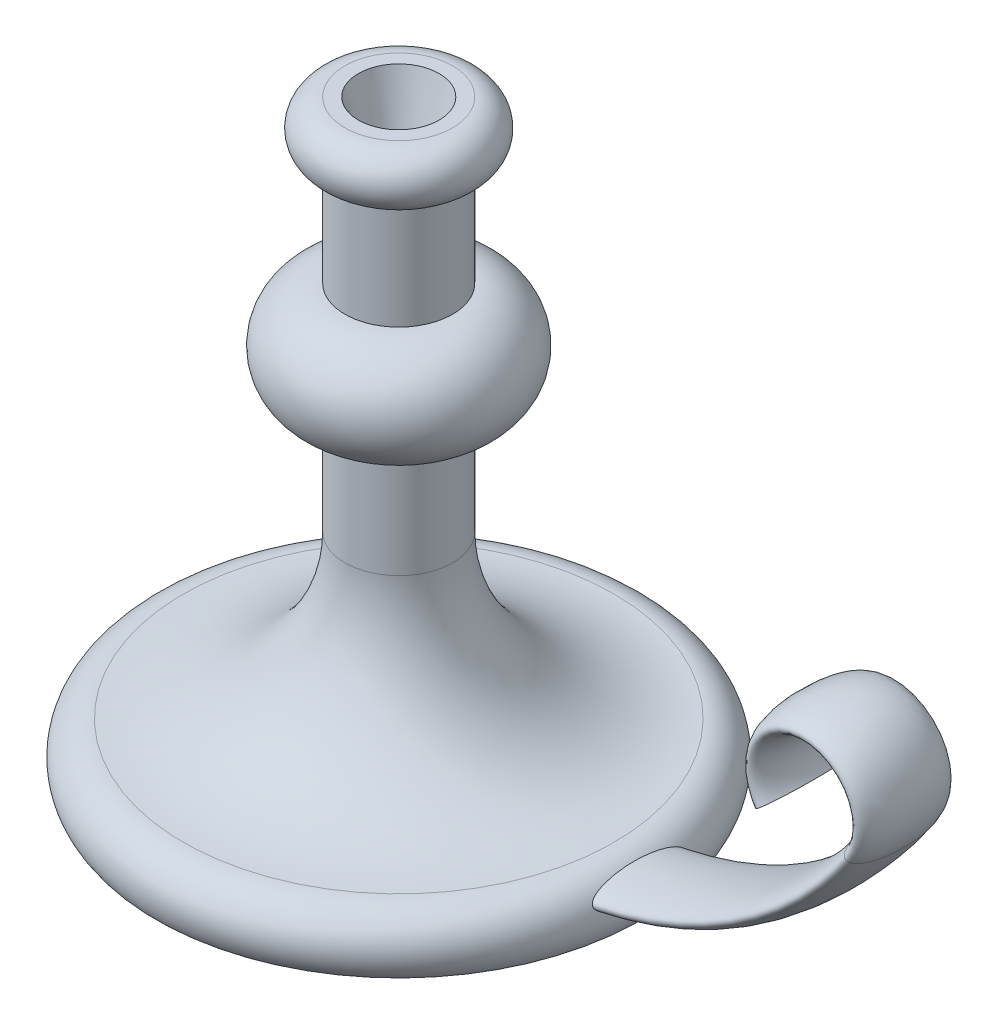
from build123d import *

# Parameters (mm, degrees)
SKETCH3_RX         = 17.5
SKETCH3_RY         = 5
SKETCH4_R          = 15
CUT_EXTRUDE2_DEPTH = 25
CUT_EXTRUDE2_DRAFT = -15


with BuildPart() as part:
    # Sketch1 → Revolve1 (revolve)
    with BuildSketch(Plane.XY, mode=Mode.PRIVATE) as revolve1_sk:
        with BuildLine():
            Line((0, 0), (0, 220))
            Line((0, 220), (20, 220))
            ThreePointArc((20, 220), (30, 210), (20, 200))
            Line((20, 200), (20, 160))
            ThreePointArc((20, 160), (40, 140), (20, 120))
            Line((20, 120), (20, 80))
            ThreePointArc((20, 80), (37.573593129, 37.573593129), (80, 20))
            ThreePointArc((80, 20), (91.180339887, 13.090169944), (90, 0))
            Line((90, 0), (0, 0))
        make_face()
    revolve(revolve1_sk.sketch.rotate(Axis((0, 0, 0), (0, 1, 0)), 90), axis=Axis((0, 0, 0), (0, 1, 0)))

    # Sweep1: sweep along a path in Sketch2
    with BuildLine(Plane.XY) as sweep1_path:
        Line((0, 10), (60, 10))
        ThreePointArc((60, 10), (129.821200219, 27.240819526), (183.592070943, 75))
        ThreePointArc((183.592070943, 75), (167.113128151, 106.333333333), (150.634185358, 75))
    # Sketch3 → Sweep1 (sweep)
    with BuildSketch(Plane(origin=(0, 0, 0), x_dir=(0, 0, -1), z_dir=(1, 0, 0))):
        with Locations(Location((0, 10), (0, 0, 180))):
            Ellipse(SKETCH3_RX, SKETCH3_RY)
    sweep(path=sweep1_path.line)


with BuildPart() as cut_extrude2_tool:
    # Sketch4 → Cut-Extrude2 (with draft: the straight prism first)
    with BuildSketch(Plane(origin=(0, 220, 0), x_dir=(1, 0, 0), z_dir=(0, 1, 0))):
        Circle(SKETCH4_R)
    extrude(amount=-CUT_EXTRUDE2_DEPTH)
    # Cut-Extrude2: the draft: its side faces are tilted about the plane it starts from
    cut_extrude2_sides = [cut_extrude2_tool.faces().sort_by_distance(p)[0] for p in [
        (-15, 207.5, 0),
    ]]
    draft(cut_extrude2_sides, Plane(origin=(0, 220, 0), x_dir=(1, 0, 0), z_dir=(0, 1, 0)), CUT_EXTRUDE2_DRAFT)


with BuildPart() as part_1:
    add(part.part)

    # Cut-Extrude2: cut by cut_extrude2_tool
    add(cut_extrude2_tool.part, mode=Mode.SUBTRACT)


solid = part_1.part
